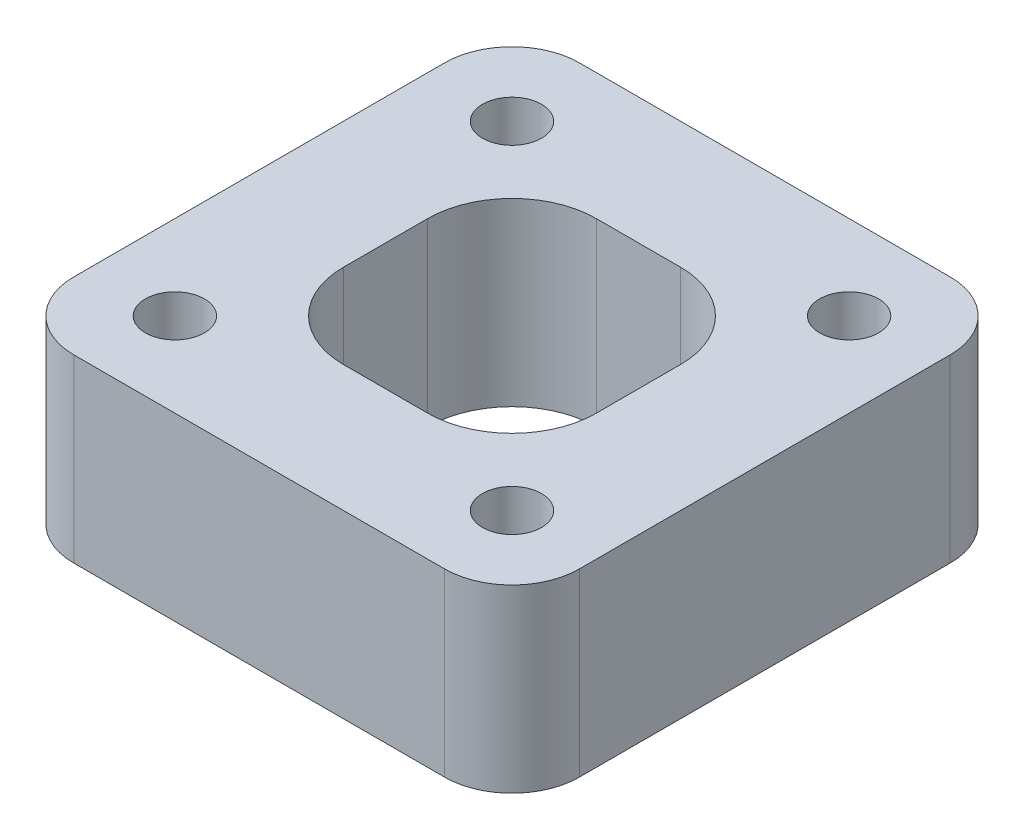
from build123d import *

# Parameters (mm, degrees)
SKETCH_1_W             = 30
SKETCH_1_H             = 30
EXTRUDE_398_DEPTH      = 5.35
SKETCH_2_R             = 1.75
CUT_EXTRUDE_618_DEPTH  = 24.758998295
SKETCH_4_W             = 15
SKETCH_4_H             = 15
CUT_EXTRUDE_1118_DEPTH = 24.758998295
FILLET_3_R             = 5
FILLET_6_R             = 4


with BuildPart() as part:
    # Эскиз1 → Extrude 398 (new, symmetric)
    with BuildSketch(Plane(origin=(0, 0, 0), x_dir=(1, 0, 0), z_dir=(0, 1, 0))):
        Rectangle(SKETCH_1_W, SKETCH_1_H)
    extrude(amount=EXTRUDE_398_DEPTH, both=True)

    # Эскиз2 → Cut-Extrude 618 (cut, through all)
    with BuildSketch(Plane(origin=(0, -5.35, 0), x_dir=(1, 0, 0), z_dir=(0, 1, 0))):
        with Locations(Location((-10, 10, 0), (0, 0, 270))):
            Circle(SKETCH_2_R)
        with Locations(Location((10, 10, 0), (0, 0, 270))):
            Circle(SKETCH_2_R)
        with Locations(Location((10, -10, 0), (0, 0, 270))):
            Circle(SKETCH_2_R)
        with Locations(Location((-10, -10, 0), (0, 0, 270))):
            Circle(SKETCH_2_R)
    extrude(amount=CUT_EXTRUDE_618_DEPTH, mode=Mode.SUBTRACT)

    # Эскиз4 → Cut-Extrude 1118 (cut, through all)
    with BuildSketch(Plane(origin=(0, 5.35, 0), x_dir=(1, 0, 0), z_dir=(0, 1, 0))):
        Rectangle(SKETCH_4_W, SKETCH_4_H)
    extrude(amount=-CUT_EXTRUDE_1118_DEPTH, mode=Mode.SUBTRACT)

    # Скругление3
    fillet_3_edges = [part.edges().sort_by_distance(p)[0] for p in [
        (-7.5, 0, 7.5),
        (-7.5, 0, -7.5),
        (7.5, 0, -7.5),
        (7.5, 0, 7.5),
    ]]
    fillet(fillet_3_edges, radius=FILLET_3_R)

    # Скругление6
    fillet_6_edges = [part.edges().sort_by_distance(p)[0] for p in [
        (15, 0, 15),
        (-15, 0, 15),
        (-15, 0, -15),
        (15, 0, -15),
    ]]
    fillet(fillet_6_edges, radius=FILLET_6_R)


solid = part.part
